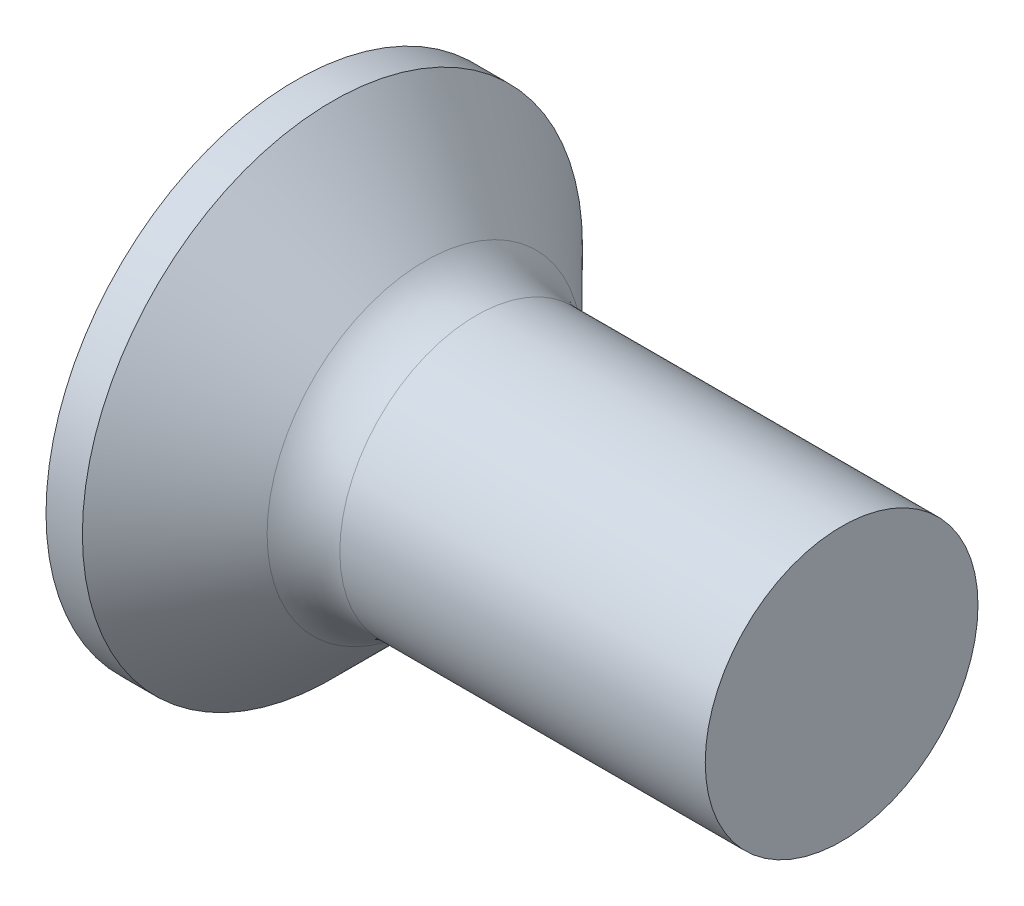
from build123d import *

# Parameters (mm, degrees)
FILLET1_R    = 0.8
RECPAT_COUNT = 2
RECPAT_ANGLE = 90


with BuildPart() as part:
    # BodySke → Base-Revolve (revolve)
    with BuildSketch(Plane.XY, mode=Mode.PRIVATE) as base_revolve_sk:
        Polygon((0, 0), (0, 2.75), (0.4, 2.75), (1.65, 1.5), (6, 1.5), (6, 0), align=None)
    revolve(base_revolve_sk.sketch.rotate(Axis((-6.35, 0, 0), (1, 0, 0)), 90), axis=Axis((-6.35, 0, 0), (1, 0, 0)))

    # Fillet1
    fillet1_edges = [part.edges().sort_by_distance(p)[0] for p in [
        (1.65, 0, -1.5),
    ]]
    fillet(fillet1_edges, radius=FILLET1_R)

    # Sketch3 → Recess section 0
    with BuildSketch(Plane.ZY):
        with BuildLine():
            Line((-0.37, 1.5), (0.37, 1.5))
            Line((0.37, 1.5), (0.37, -1.5))
            Line((0.37, -1.5), (-0.37, -1.5))
            Line((-0.37, -1.5), (-0.37, 1.5))
        make_face()
    # Sketch4 → Recess section 1
    with BuildSketch(Plane.ZY.offset(-2.01)):
        with BuildLine():
            Line((-0.37, 0.497851135), (0.37, 0.497851135))
            Line((0.37, 0.497851135), (0.37, -0.497851135))
            Line((0.37, -0.497851135), (-0.37, -0.497851135))
            Line((-0.37, -0.497851135), (-0.37, 0.497851135))
        make_face()
    recess = loft(mode=Mode.SUBTRACT)

    # RecPat: Recess ×2 about axis
    recpat_axis = Axis((0, 0, 0), (1, 0, 0))
    for i in range(1, RECPAT_COUNT):
        add(recess.rotate(recpat_axis, i * RECPAT_ANGLE / (RECPAT_COUNT - 1)), mode=Mode.SUBTRACT)

    # RecCorSke → RecessCore (revolve, cut)
    with BuildSketch(Plane.XY, mode=Mode.PRIVATE) as recesscore_sk:
        Polygon((0, 0), (0, 0.696552892), (2.01, 0.556), (2.190655351, 0), align=None)
    revolve(recesscore_sk.sketch.rotate(Axis((-3.175, 0, 0), (1, 0, 0)), 90), axis=Axis((-3.175, 0, 0), (1, 0, 0)), mode=Mode.SUBTRACT)


solid = part.part
